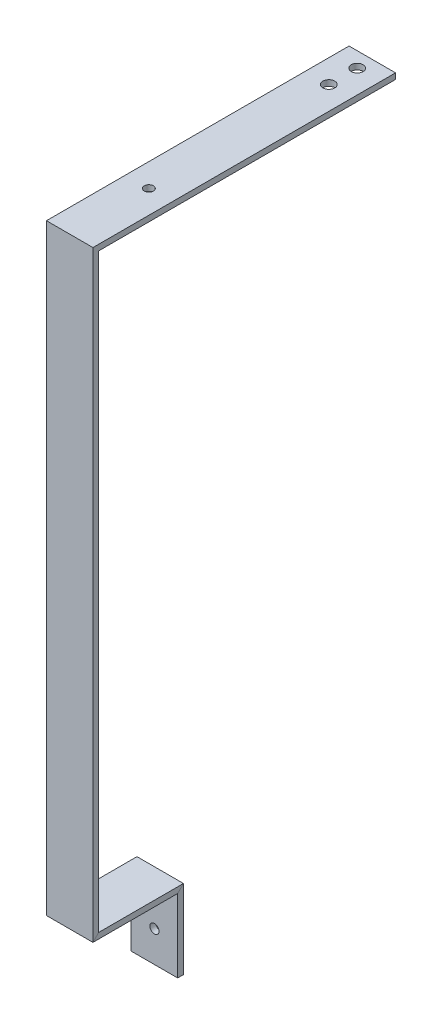
from build123d import *

# Parameters (mm, degrees)
CROQUIS1_W              = 50.8
CROQUIS1_H              = 6.31
SALIENTE_EXTRUIR1_DEPTH = 330.7
CROQUIS3_W              = 50.8
CROQUIS3_H              = 6.31
SALIENTE_EXTRUIR2_DEPTH = 638.2
CROQUIS7_W              = 50.8
CROQUIS7_H              = 6.31
CROQUIS8_R              = 5
CORTAR_EXTRUIR2_DEPTH   = 15.875
CROQUIS9_R              = 6.5
CORTAR_EXTRUIR3_DEPTH   = 15.875
CROQUIS11_R             = 5
CORTAR_EXTRUIR5_DEPTH   = 10


with BuildPart() as part:
    # Croquis1 → Saliente-Extruir1 (new body)
    with BuildSketch(Plane.XY):
        Rectangle(CROQUIS1_W, CROQUIS1_H)
    extrude(amount=SALIENTE_EXTRUIR1_DEPTH)

    # Croquis3 → Saliente-Extruir2 (add)
    with BuildSketch(Plane.XZ.offset(3.155)):
        with Locations((0, 327.545)):
            Rectangle(CROQUIS3_W, CROQUIS3_H)
    extrude(amount=SALIENTE_EXTRUIR2_DEPTH)

    # Barrer1: sweep along a curve in space
    with BuildLine() as barrer1_path:
        Line((0, -641.355, 327.545), (0, -651.355, 327.545))
        Line((0, -651.355, 327.545), (0, -651.355, 234.935))
        Line((0, -651.355, 234.935), (0, -734.515, 234.935))
    # Croquis7 → Barrer1 (sweep)
    with BuildSketch(Plane.XZ.offset(641.355)):
        with Locations((0, 327.545)):
            Rectangle(CROQUIS7_W, CROQUIS7_H)
    sweep(path=barrer1_path.line, transition=Transition.RIGHT)

    # Croquis8 → Cortar-Extruir2 (cut)
    with BuildSketch(Plane(origin=(0, 0, 231.78), x_dir=(-1, 0, 0), z_dir=(0, 0, -1))):
        with Locations((0, -700.505)):
            Circle(CROQUIS8_R)
    extrude(amount=-CORTAR_EXTRUIR2_DEPTH, mode=Mode.SUBTRACT)

    # Croquis9 → Cortar-Extruir3 (cut)
    with BuildSketch(Plane(origin=(0, 3.155, 0), x_dir=(1, 0, 0), z_dir=(0, 1, 0))):
        with Locations(Location((0, -47.5, 0), (0, 0, 270))):
            Circle(CROQUIS9_R)
        with Locations(Location((0, -16.5, 0), (0, 0, 270))):
            Circle(CROQUIS9_R)
    extrude(amount=-CORTAR_EXTRUIR3_DEPTH, mode=Mode.SUBTRACT)

    # Croquis11 → Cortar-Extruir5 (cut)
    with BuildSketch(Plane(origin=(0, 3.155, 0), x_dir=(1, 0, 0), z_dir=(0, 1, 0))):
        with Locations(Location((0, -244.19, 0), (0, 0, 270))):
            Circle(CROQUIS11_R)
    extrude(amount=-CORTAR_EXTRUIR5_DEPTH, mode=Mode.SUBTRACT)


solid = part.part
